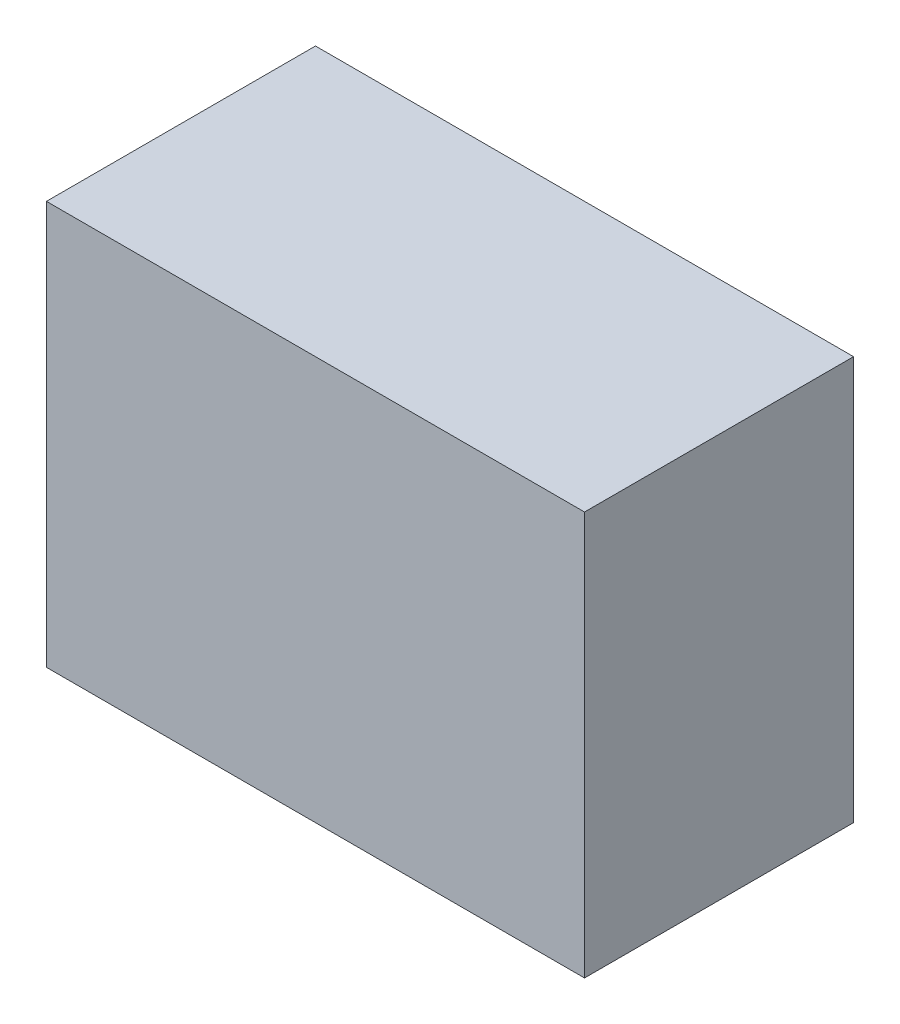
from build123d import *

# Parameters (mm, degrees)
SKETCH1_W           = 40
SKETCH1_H           = 30
BOSS_EXTRUDE1_DEPTH = 20


with BuildPart() as part:
    # Sketch1 → Boss-Extrude1 (new body)
    with BuildSketch(Plane.XY):
        Rectangle(SKETCH1_W, SKETCH1_H)
    extrude(amount=BOSS_EXTRUDE1_DEPTH)


solid = part.part
